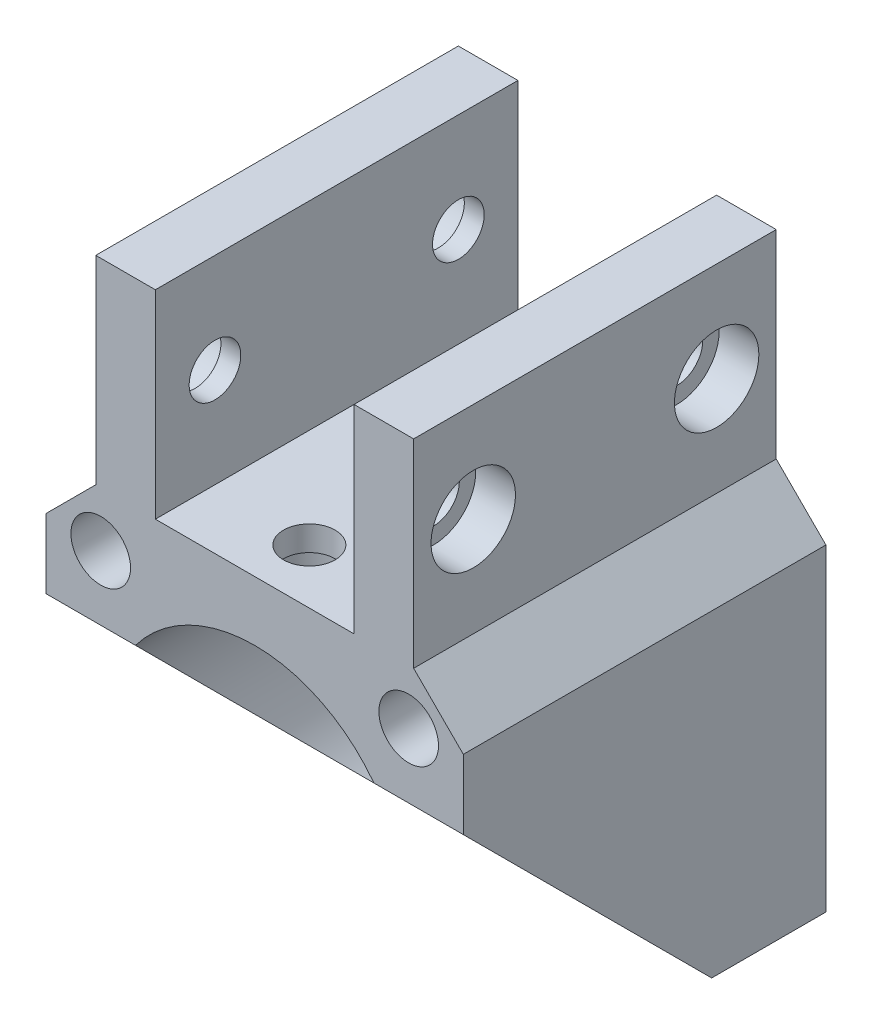
from build123d import *

# Parameters (mm, degrees)
SKETCH_1_W               = 42
SKETCH_1_H               = 42
EXTRUDE_1_DEPTH          = 6.5
EXTRUDE_2_DEPTH          = 42
SKETCH_2_R               = 15
CUT_EXTRUDE_2_DEPTH      = 57.870466852
SKETCH_4_R               = 1.75
CUT_EXTRUDE_1_DEPTH      = 57.870466852
CHAMFER_1_SIZE           = 5
CUT_EXTRUDE_3_DEPTH      = 68.507407001
SKETCH_7_R               = 3
CUT_EXTRUDE_4_DEPTH      = 31.5
CUT_EXTRUDE_5_DEPTH      = 48.055817919
CUT_EXTRUDE_5_DEPTH_BACK = 5
SKETCH_8_R               = 2.6
SKETCH_9_R               = 4.25
CUT_EXTRUDE_6_DEPTH      = 18.5
SKETCH_10_R              = 15
SKETCH_10_R_2            = 11.5
EXTRUDE_3_DEPTH          = 3
SKETCH_11_W              = 6
SKETCH_11_H              = 36.5
EXTRUDE_4_DEPTH          = 20
CUT_EXTRUDE_7_DEPTH      = 67.198564994
CUT_EXTRUDE_7_DEPTH_BACK = 67.198564994
SKETCH_12_R              = 2.6
SKETCH_13_R              = 4.25
CUT_EXTRUDE_8_DEPTH      = 4
CUT_EXTRUDE_START        = -4
SKETCH_14_R              = 4.25
CUT_EXTRUDE_9_DEPTH      = 4


with BuildPart() as part:
    # 草圖1 → 填料-伸長1 (new body)
    with BuildSketch(Plane.XY):
        Rectangle(SKETCH_1_W, SKETCH_1_H)
    extrude(amount=EXTRUDE_1_DEPTH)

    # 草圖5 → 填料-伸長2 (add)
    with BuildSketch(Plane(origin=(21, 0, 0), x_dir=(0, 0, -1), z_dir=(1, 0, 0))):
        Polygon((-6.5, -21), (-48.5, 21), (-6.5, 21), align=None)
    extrude(amount=-EXTRUDE_2_DEPTH)

    # 草圖2 → 除料-伸長2 (cut, through all)
    with BuildSketch(Plane.XY):
        with Locations(Location((0, 0, 0), (0, 0, 270))):
            Circle(SKETCH_2_R)
    extrude(amount=CUT_EXTRUDE_2_DEPTH, mode=Mode.SUBTRACT)

    # 草圖4 → 除料-伸長1 (cut, through all)
    with BuildSketch(Plane.XY):
        with Locations(Location((-15.5, 15.5, 0), (0, 0, 270))):
            Circle(SKETCH_4_R)
        with Locations(Location((-15.5, -15.5, 0), (0, 0, 180))):
            Circle(SKETCH_4_R)
        with Locations(Location((15.5, -15.5, 0), (0, 0, 270))):
            Circle(SKETCH_4_R)
        with Locations(Location((15.5, 15.5, 0), (0, 0, 180))):
            Circle(SKETCH_4_R)
    extrude(amount=CUT_EXTRUDE_1_DEPTH, mode=Mode.SUBTRACT)

    # 導角1
    chamfer_1_edges = [part.edges().sort_by_distance(p)[0] for p in [
        (-21, 21, 24.25),
        (21, 21, 24.25),
        (21, -21, 3.25),
        (-21, -21, 3.25),
    ]]
    chamfer(chamfer_1_edges, length=CHAMFER_1_SIZE)

    # 草圖6 → 除料-伸長3 (cut, through all)
    with BuildSketch(Plane.ZY.offset(21)):
        Polygon((48.5, 21), (36.5, 21), (36.5, 9), align=None)
    extrude(amount=-CUT_EXTRUDE_3_DEPTH, mode=Mode.SUBTRACT)

    # 草圖7 → 除料-伸長4 (cut)
    with BuildSketch(Plane.XY.offset(36.5)):
        with Locations((-15.5, 15.5)):
            Circle(SKETCH_7_R)
        with Locations((15.5, 15.5)):
            Circle(SKETCH_7_R)
        with Locations((15.5, -15.5)):
            Circle(SKETCH_7_R)
        with Locations((-15.5, -15.5)):
            Circle(SKETCH_7_R)
    extrude(amount=-CUT_EXTRUDE_4_DEPTH, mode=Mode.SUBTRACT)

    # 草圖8 → 除料-伸長5 (cut, two sides: drawn at the far end of the back side and taken through both)
    with BuildSketch(Plane(origin=(0, 0, 0), x_dir=(1, 0, 0), z_dir=(0, 1, 0)).offset(-CUT_EXTRUDE_5_DEPTH_BACK)):
        with Locations(Location((0, -15, 0), (0, 0, 90))):
            Circle(SKETCH_8_R)
        with Locations(Location((0, -31, 0), (0, 0, 90))):
            Circle(SKETCH_8_R)
    extrude(amount=CUT_EXTRUDE_5_DEPTH + CUT_EXTRUDE_5_DEPTH_BACK, mode=Mode.SUBTRACT)

    # 草圖9 → 除料-伸長6 (cut)
    with BuildSketch(Plane(origin=(0, 0, 0), x_dir=(1, 0, 0), z_dir=(0, 1, 0))):
        with Locations(Location((0, -31, 0), (0, 0, 90))):
            Circle(SKETCH_9_R)
        with Locations(Location((0, -15, 0), (0, 0, 90))):
            Circle(SKETCH_9_R)
    extrude(amount=CUT_EXTRUDE_6_DEPTH, mode=Mode.SUBTRACT)

    # 草圖10 → 填料-伸長3 (add)
    with BuildSketch(Plane(origin=(0, 0, 0), x_dir=(-1, 0, 0), z_dir=(0, 0, -1))):
        Circle(SKETCH_10_R)
        Circle(SKETCH_10_R_2, mode=Mode.SUBTRACT)
    extrude(amount=-EXTRUDE_3_DEPTH)

    # 草圖11 → 填料-伸長4 (add)
    with BuildSketch(Plane(origin=(0, 21, 0), x_dir=(1, 0, 0), z_dir=(0, 1, 0))):
        with Locations((13, -18.25)):
            Rectangle(SKETCH_11_W, SKETCH_11_H)
        with Locations((-13, -18.25)):
            Rectangle(SKETCH_11_W, SKETCH_11_H)
    extrude(amount=EXTRUDE_4_DEPTH)

    # 草圖12 → 除料-伸長7 (cut, two sides: drawn at the far end of the back side and taken through both)
    with BuildSketch(Plane(origin=(16, 0, 0), x_dir=(0, 0, -1), z_dir=(1, 0, 0)).offset(-CUT_EXTRUDE_7_DEPTH_BACK)):
        with Locations((-30.5, 31)):
            Circle(SKETCH_12_R)
        with Locations((-6, 31)):
            Circle(SKETCH_12_R)
    extrude(amount=CUT_EXTRUDE_7_DEPTH + CUT_EXTRUDE_7_DEPTH_BACK, mode=Mode.SUBTRACT)

    # 草圖13 → 除料-伸長8 (cut)
    with BuildSketch(Plane(origin=(16, 0, 0), x_dir=(0, 0, -1), z_dir=(1, 0, 0))):
        with Locations((-30.5, 31)):
            Circle(SKETCH_13_R)
        with Locations((-6, 31)):
            Circle(SKETCH_13_R)
    extrude(amount=-CUT_EXTRUDE_8_DEPTH, mode=Mode.SUBTRACT)

    # 草圖14 → 除料-伸長9 (cut)
    with BuildSketch(Plane.ZY.offset(16).offset(CUT_EXTRUDE_START)):
        with Locations(Location((30.5, 31, 0), (0, 0, 180))):
            Circle(SKETCH_14_R)
        with Locations(Location((6, 31, 0), (0, 0, 180))):
            Circle(SKETCH_14_R)
    extrude(amount=CUT_EXTRUDE_9_DEPTH, mode=Mode.SUBTRACT)


solid = part.part
